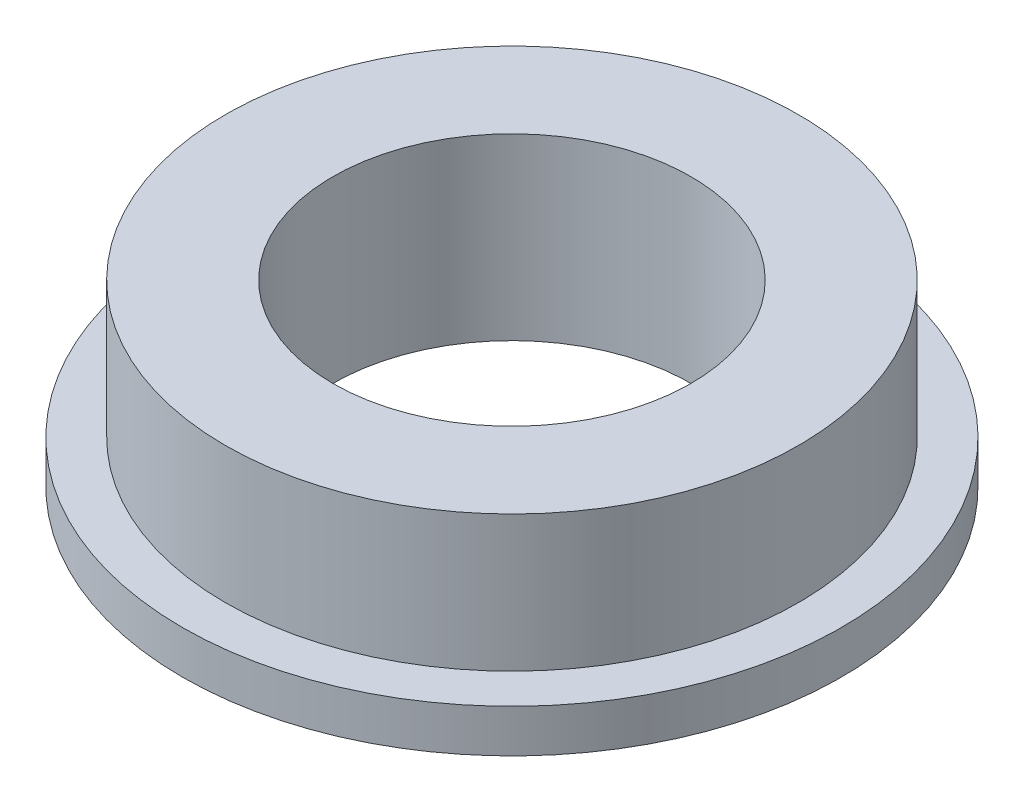
from build123d import *

# Parameters (mm, degrees)
SKETCH1_R           = 4.6
SKETCH1_R_2         = 2.5
BOSS_EXTRUDE1_DEPTH = 0.6
SKETCH2_R           = 4
SKETCH2_R_2         = 2.5
BOSS_EXTRUDE2_DEPTH = 2.5


with BuildPart() as part:
    # Sketch1 → Boss-Extrude1 (new body)
    with BuildSketch(Plane(origin=(0, 0, 0), x_dir=(1, 0, 0), z_dir=(0, 1, 0))):
        with Locations(Location((0, 0, 0), (0, 0, 270))):
            Circle(SKETCH1_R)
        with Locations(Location((0, 0, 0), (0, 0, 270))):
            Circle(SKETCH1_R_2, mode=Mode.SUBTRACT)
    extrude(amount=BOSS_EXTRUDE1_DEPTH)

    # Sketch2 → Boss-Extrude2 (add)
    with BuildSketch(Plane(origin=(0, 0, 0), x_dir=(1, 0, 0), z_dir=(0, 1, 0))):
        with Locations(Location((0, 0, 0), (0, 0, 270))):
            Circle(SKETCH2_R)
        with Locations(Location((0, 0, 0), (0, 0, 270))):
            Circle(SKETCH2_R_2, mode=Mode.SUBTRACT)
    extrude(amount=BOSS_EXTRUDE2_DEPTH)


solid = part.part
